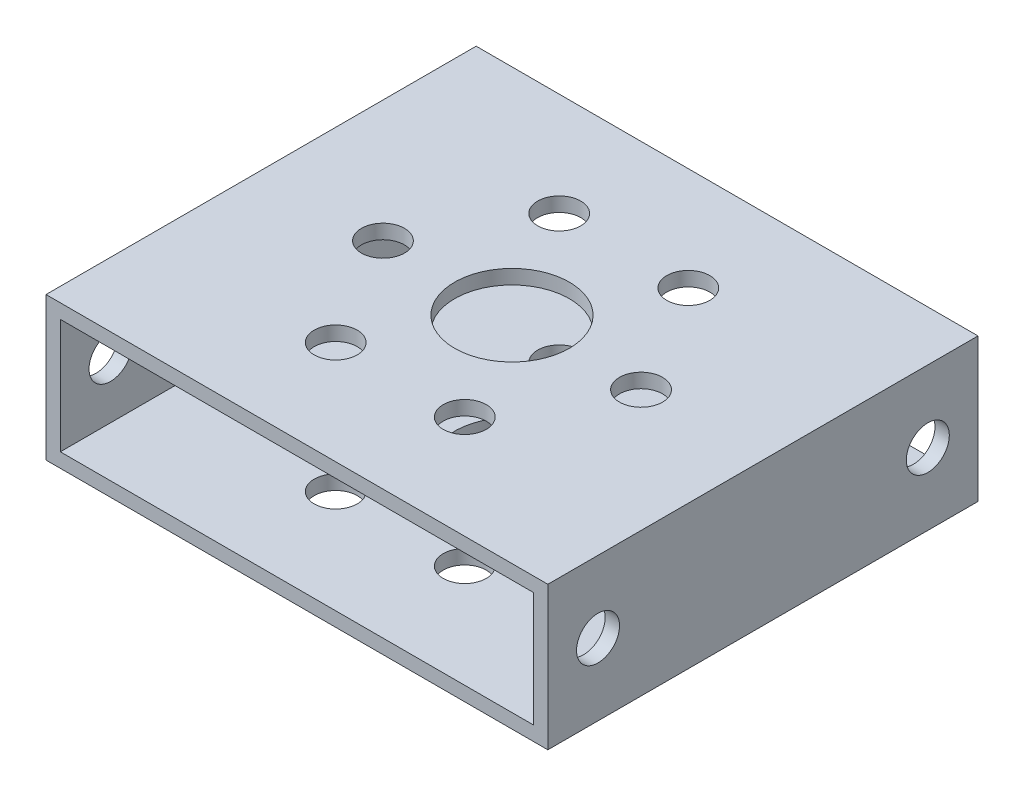
from build123d import *

# Parameters (mm, degrees)
SKETCH_1_W          = 35
SKETCH_1_H          = 10
SKETCH_1_W_2        = 33
SKETCH_1_H_2        = 8
EXTRUDE_1_DEPTH     = 15
SKETCH_2_R          = 1.5
CUT_EXTRUDE_1_DEPTH = 50
SKETCH_3_R          = 4
SKETCH_3_R_2        = 1.5
CUT_EXTRUDE_2_DEPTH = 10


with BuildPart() as part:
    # 草图1 → 凸台-拉伸1 (new, symmetric)
    with BuildSketch(Plane.XY):
        Rectangle(SKETCH_1_W, SKETCH_1_H)
        Rectangle(SKETCH_1_W_2, SKETCH_1_H_2, mode=Mode.SUBTRACT)
    extrude(amount=EXTRUDE_1_DEPTH, both=True)

    # 草图2 → 切除-拉伸1 (cut)
    with BuildSketch(Plane(origin=(17.5, 0, 0), x_dir=(0, 0, -1), z_dir=(1, 0, 0))):
        with Locations((11.5, 0)):
            Circle(SKETCH_2_R)
        with Locations((-11.5, 0)):
            Circle(SKETCH_2_R)
    extrude(amount=-CUT_EXTRUDE_1_DEPTH, mode=Mode.SUBTRACT)

    # 草图3 → 切除-拉伸2 (cut)
    with BuildSketch(Plane(origin=(0, 5, 0), x_dir=(1, 0, 0), z_dir=(0, 1, 0))):
        with Locations(Location((0, 0, 0), (0, 0, 270))):
            Circle(SKETCH_3_R)
        with Locations(Location((-4.5, 7.794228634, 0), (0, 0, 270))):
            Circle(SKETCH_3_R_2)
        with Locations(Location((4.5, 7.794228634, 0), (0, 0, 270))):
            Circle(SKETCH_3_R_2)
        with Locations(Location((9, 0, 0), (0, 0, 270))):
            Circle(SKETCH_3_R_2)
        with Locations(Location((4.5, -7.794228634, 0), (0, 0, 270))):
            Circle(SKETCH_3_R_2)
        with Locations(Location((-4.5, -7.794228634, 0), (0, 0, 270))):
            Circle(SKETCH_3_R_2)
        with Locations(Location((-9, 0, 0), (0, 0, 270))):
            Circle(SKETCH_3_R_2)
    extrude(amount=-CUT_EXTRUDE_2_DEPTH, mode=Mode.SUBTRACT)


solid = part.part
